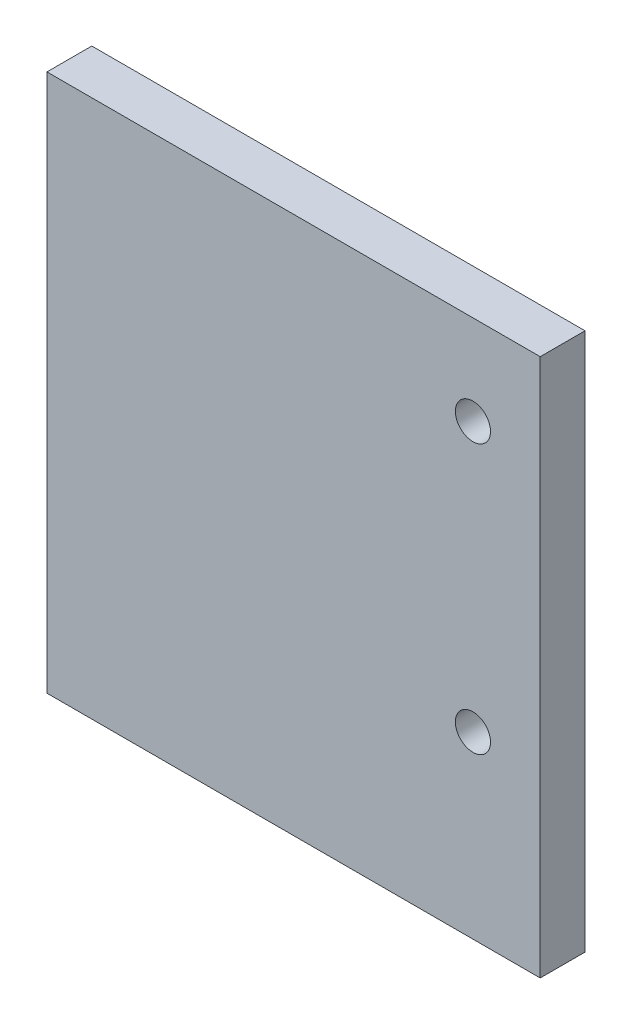
from build123d import *

# Parameters (mm, degrees)
SKETCH1_W           = 69.85
SKETCH1_H           = 76.2
SKETCH1_R           = 2.4892
BOSS_EXTRUDE1_DEPTH = 3.175


with BuildPart() as part:
    # Sketch1 → Boss-Extrude1 (new, symmetric)
    with BuildSketch(Plane.XY):
        Rectangle(SKETCH1_W, SKETCH1_H)
        with Locations((25.4, 25.4)):
            Circle(SKETCH1_R, mode=Mode.SUBTRACT)
        with Locations((25.4, -12.7)):
            Circle(SKETCH1_R, mode=Mode.SUBTRACT)
    extrude(amount=BOSS_EXTRUDE1_DEPTH, both=True)


solid = part.part
